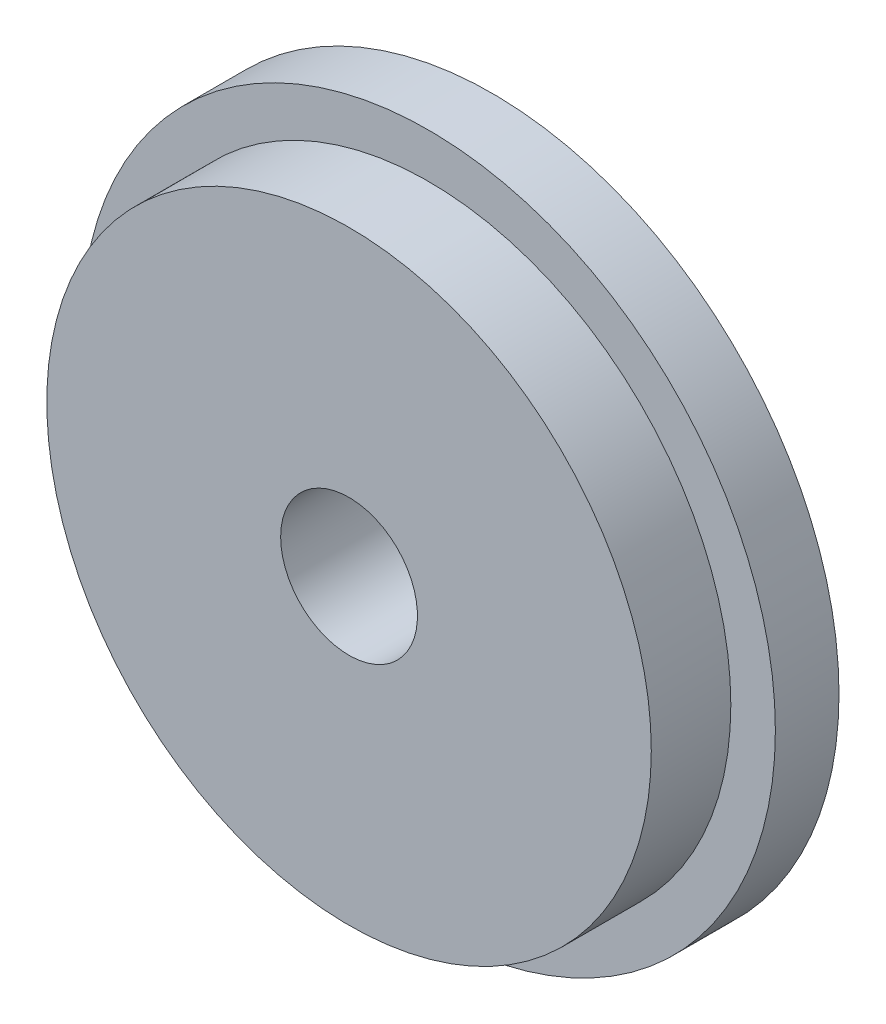
from build123d import *

# Parameters (mm, degrees)
SKETCH1_R           = 10.9
BOSS_EXTRUDE1_DEPTH = 2
SKETCH2_R           = 9.5
BOSS_EXTRUDE2_DEPTH = 2.5
SKETCH3_R           = 2.15
CUT_EXTRUDE1_DEPTH  = 17.058331171


with BuildPart() as part:
    # Sketch1 → Boss-Extrude1 (new body)
    with BuildSketch(Plane.XY):
        Circle(SKETCH1_R)
    extrude(amount=BOSS_EXTRUDE1_DEPTH)

    # Sketch2 → Boss-Extrude2 (add)
    with BuildSketch(Plane.XY.offset(2)):
        Circle(SKETCH2_R)
    extrude(amount=BOSS_EXTRUDE2_DEPTH)

    # Sketch3 → Cut-Extrude1 (cut, through all)
    with BuildSketch(Plane(origin=(0, 0, 0), x_dir=(-1, 0, 0), z_dir=(0, 0, -1))):
        Circle(SKETCH3_R)
    extrude(amount=-CUT_EXTRUDE1_DEPTH, mode=Mode.SUBTRACT)


solid = part.part
